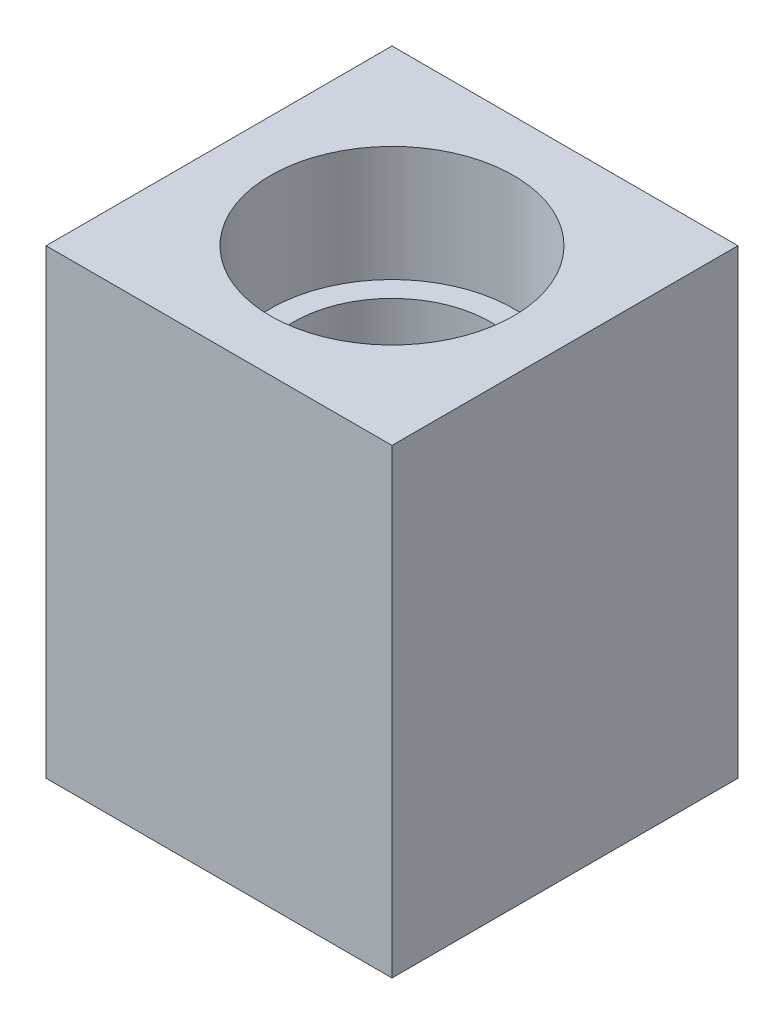
from build123d import *

# Parameters (mm, degrees)
SKETCH1_W           = 15
SKETCH1_H           = 15
BOSS_EXTRUDE1_DEPTH = 20
SKETCH2_R           = 4.275
CUT_EXTRUDE1_DEPTH  = 20
SKETCH3_R           = 5.275
CUT_EXTRUDE2_DEPTH  = 5


with BuildPart() as part:
    # Sketch1 → Boss-Extrude1 (new body)
    with BuildSketch(Plane(origin=(0, 0, 0), x_dir=(1, 0, 0), z_dir=(0, 1, 0))):
        Rectangle(SKETCH1_W, SKETCH1_H)
    extrude(amount=BOSS_EXTRUDE1_DEPTH)

    # Sketch2 → Cut-Extrude1 (cut)
    with BuildSketch(Plane(origin=(0, 20, 0), x_dir=(1, 0, 0), z_dir=(0, 1, 0))):
        with Locations(Location((0, 0, 0), (0, 0, 270))):
            Circle(SKETCH2_R)
    extrude(amount=-CUT_EXTRUDE1_DEPTH, mode=Mode.SUBTRACT)

    # Sketch3 → Cut-Extrude2 (cut)
    with BuildSketch(Plane(origin=(0, 20, 0), x_dir=(1, 0, 0), z_dir=(0, 1, 0))):
        with Locations(Location((0, 0, 0), (0, 0, 270))):
            Circle(SKETCH3_R)
    extrude(amount=-CUT_EXTRUDE2_DEPTH, mode=Mode.SUBTRACT)


solid = part.part
